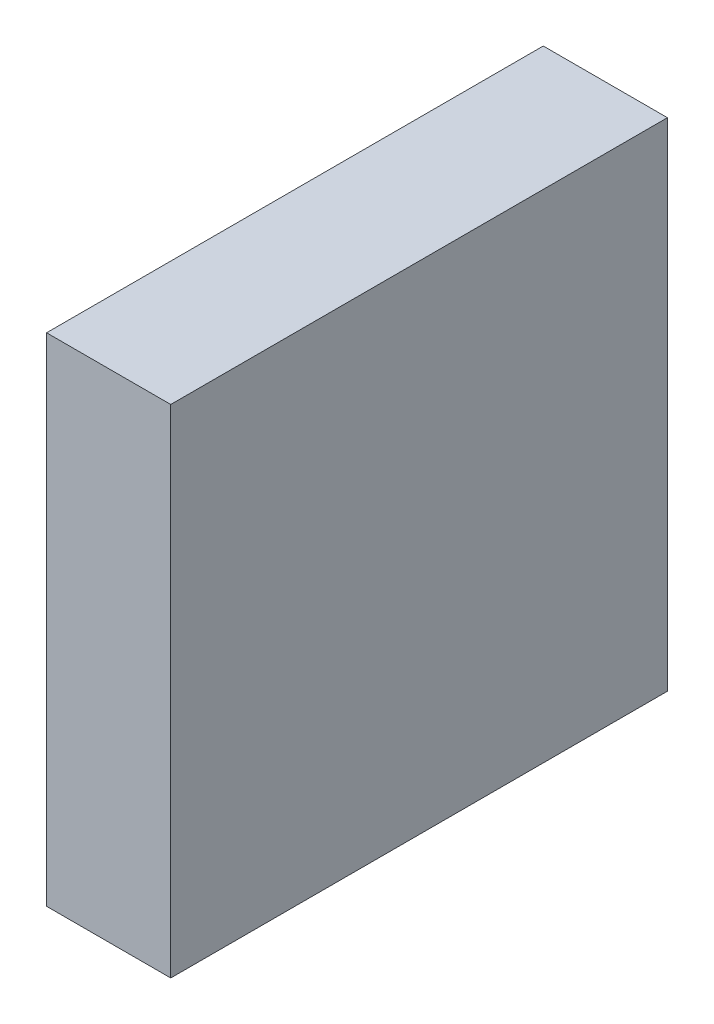
from build123d import *

# Parameters (mm, degrees)
SKETCH_1_W      = 20
SKETCH_1_H      = 20
EXTRUDE_1_DEPTH = 5


with BuildPart() as part:
    # 草图1 → 凸台-拉伸1 (new body)
    with BuildSketch(Plane(origin=(0, 0, 0), x_dir=(0, 0, -1), z_dir=(1, 0, 0))):
        with Locations((10, 10)):
            Rectangle(SKETCH_1_W, SKETCH_1_H)
    extrude(amount=EXTRUDE_1_DEPTH)


solid = part.part
